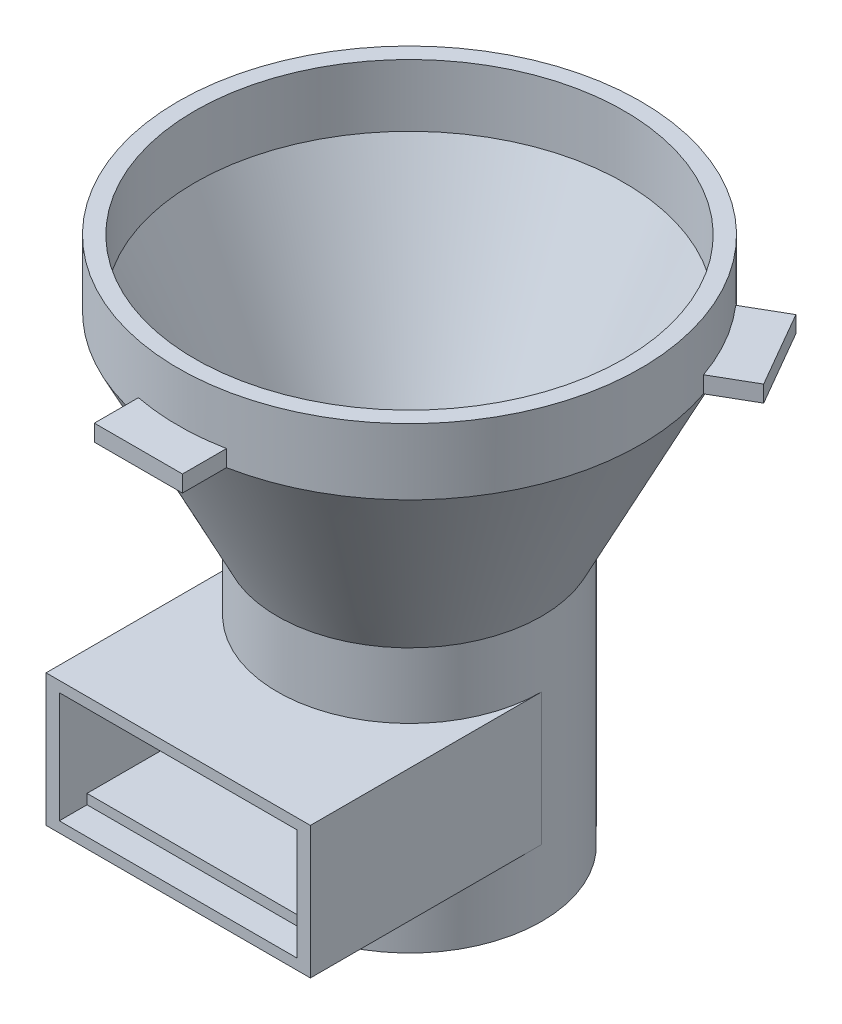
from build123d import *
from build123d.topology import SkipClean

# Parameters (mm, degrees)
SHELL1_T                = -3.175
BOSS_EXTRUDE1_START     = -3.175
BOSS_EXTRUDE1_DEPTH     = 3.175
CIRPATTERN1_COUNT       = 3
SKETCH4_W               = 50.8
SKETCH4_H               = 25.4
BOSS_EXTRUDE2_DEPTH     = 44.45
CUT_EXTRUDE1_DEPTH      = 90.727393356
CUT_EXTRUDE1_DEPTH_BACK = 90.727393356
SKETCH5_R               = 22.225
SKETCH6_W               = 45.72
SKETCH6_H               = 21.336
CUT_EXTRUDE2_DEPTH      = 40.767
BOSS_EXTRUDE3_DEPTH     = 1.905
SKETCH8_W               = 45.72
SKETCH8_H               = 1.905
BOSS_EXTRUDE4_DEPTH     = 16.256
SKETCH10_R              = 44.45
SKETCH10_R_2            = 41.275
BOSS_EXTRUDE5_DEPTH     = 9.525


with BuildPart() as part:
    # Sketch1 → Revolve1 (revolve)
    with BuildSketch(Plane.XY, mode=Mode.PRIVATE) as revolve1_sk:
        Polygon((0, 92.075), (-44.45, 92.075), (-44.45, 88.9), (-25.4, 50.8), (-25.4, 0), (0, 0), align=None)
    revolve(revolve1_sk.sketch.rotate(Axis((0, 0, 0), (0, 1, 0)), 180), axis=Axis((0, 0, 0), (0, 1, 0)))

    # Shell1
    shell1_openings = [part.faces().sort_by_distance(p)[0] for p in [
        (0, 0, 0),
        (0, 92.075, 0),
    ]]
    offset(amount=SHELL1_T, openings=shell1_openings, kind=Kind.INTERSECTION)

    # Sketch2 → Boss-Extrude1 (add)
    with BuildSketch(Plane(origin=(0, 92.075, 0), x_dir=(1, 0, 0), z_dir=(0, 1, 0)).offset(BOSS_EXTRUDE1_START)):
        with BuildLine():
            Line((0, -52.102867871), (-8.466666667, -52.102867871))
            Line((-8.466666667, -52.102867871), (-8.466666667, -43.636201204))
            ThreePointArc((-8.466666667, -43.636201204), (0, -44.45), (8.466666667, -43.636201204))
            Line((8.466666667, -43.636201204), (8.466666667, -52.102867871))
            Line((8.466666667, -52.102867871), (0, -52.102867871))
        make_face()
    boss_extrude1 = extrude(amount=BOSS_EXTRUDE1_DEPTH)

    # CirPattern1: Boss-Extrude1 ×3 about axis
    cirpattern1_axis = Axis((0, 0, 0), (0, 1, 0))
    for i in range(1, CIRPATTERN1_COUNT):
        add(boss_extrude1.rotate(cirpattern1_axis, i * 360 / CIRPATTERN1_COUNT))

    # Sketch4 → Boss-Extrude2 (add)
    with BuildSketch(Plane.XY):
        with Locations((0, 25.520500134)):
            Rectangle(SKETCH4_W, SKETCH4_H)
    extrude(amount=BOSS_EXTRUDE2_DEPTH)

    # Sketch5 → Cut-Extrude1 (cut, two sides: drawn at the far end of the back side and taken through both)
    with BuildSketch(Plane(origin=(0, 38.220500134, 0), x_dir=(1, 0, 0), z_dir=(0, 1, 0)).offset(-CUT_EXTRUDE1_DEPTH_BACK)):
        with Locations(Location((0, 0, 0), (0, 0, 180))):
            Circle(SKETCH5_R)
    extrude(amount=CUT_EXTRUDE1_DEPTH + CUT_EXTRUDE1_DEPTH_BACK, mode=Mode.SUBTRACT)

    # Sketch6 → Cut-Extrude2 (cut)
    with BuildSketch(Plane.XY.offset(44.45)):
        with Locations((0, 25.520500134)):
            Rectangle(SKETCH6_W, SKETCH6_H)
    extrude(amount=-CUT_EXTRUDE2_DEPTH, mode=Mode.SUBTRACT)

    # Sketch7 → Boss-Extrude3 (add)
    with SkipClean():  # the faces are left unmerged after this step: merging them gives an invalid solid
        with BuildSketch(Plane(origin=(0, 14.852500134, 0), x_dir=(1, 0, 0), z_dir=(0, 1, 0))):
            with BuildLine():
                Line((0, -22.860352775), (-22.86, -22.860352775))
                Line((-22.86, -22.860352775), (-22.860352775, 0))
                Line((-22.860352775, 0), (-22.225, 0))
                ThreePointArc((-22.225, 0), (-1.847898428, -22.148044979), (21.917712837, -3.683))
                Line((21.917712837, -3.683), (22.86, -3.683))
                Line((22.86, -3.683), (22.860352775, 0))
                Line((22.860352775, 0), (22.86, -22.860352775))
                Line((22.86, -22.860352775), (0, -22.860352775))
            make_face()
        extrude(amount=BOSS_EXTRUDE3_DEPTH)

    # Sketch8 → Boss-Extrude4 (add)
    with SkipClean():  # the faces are left unmerged after this step: merging them gives an invalid solid
        with BuildSketch(Plane.XY.offset(22.860352775)):
            with Locations((0, 15.805000134)):
                Rectangle(SKETCH8_W, SKETCH8_H)
        extrude(amount=BOSS_EXTRUDE4_DEPTH)

    # Sketch10 → Boss-Extrude5 (add)
    with BuildSketch(Plane(origin=(0, 92.075, 0), x_dir=(1, 0, 0), z_dir=(0, 1, 0))):
        with Locations(Location((0, 0, 0), (0, 0, 19.019424572))):
            Circle(SKETCH10_R)
        with Locations(Location((0, 0, 0), (0, 0, 180))):
            Circle(SKETCH10_R_2, mode=Mode.SUBTRACT)
    extrude(amount=BOSS_EXTRUDE5_DEPTH)


solid = part.part
